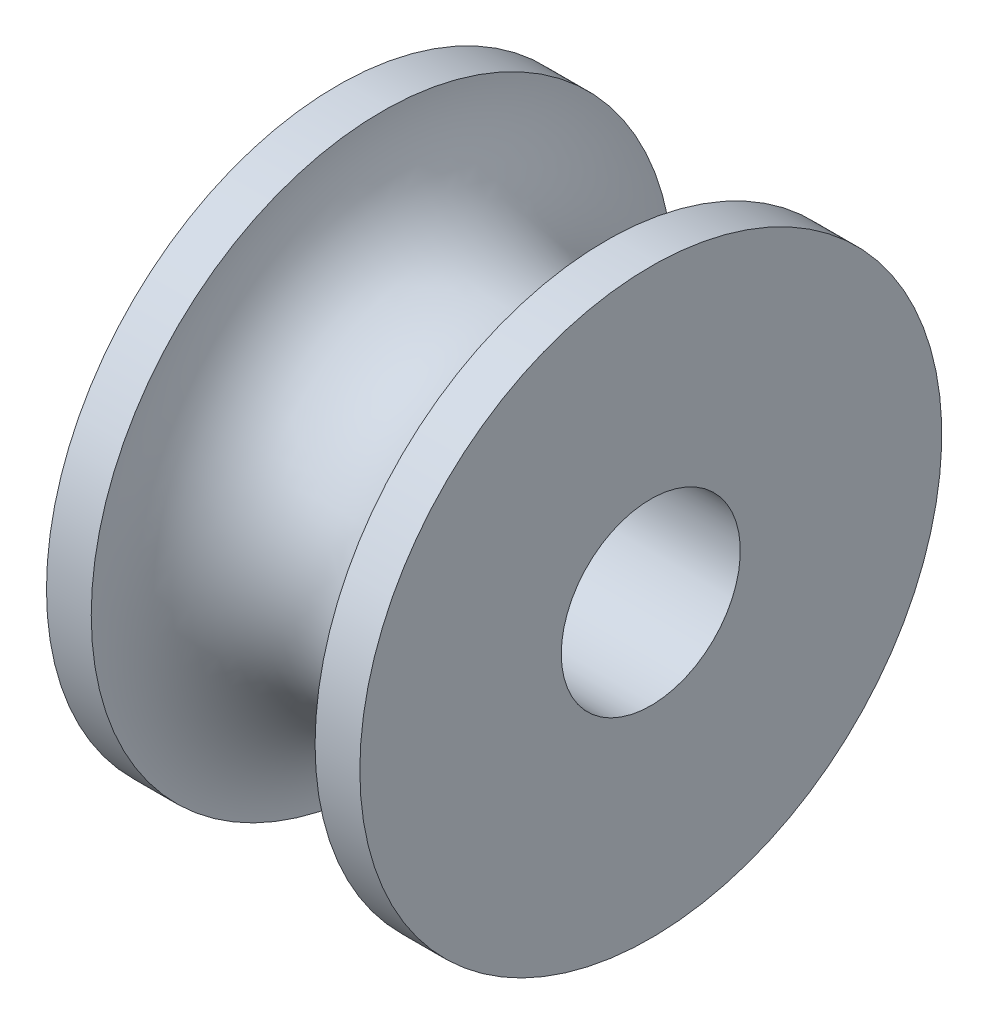
from build123d import *


with BuildPart() as part:
    # Sketch1 → Revolve1 (revolve)
    with BuildSketch(Plane.XY, mode=Mode.PRIVATE) as revolve1_sk:
        with BuildLine():
            Line((-3.5, 2), (-3.5, 6.5))
            Line((-3.5, 6.5), (-2.5, 6.5))
            ThreePointArc((-2.5, 6.5), (0, 4), (2.5, 6.5))
            Line((2.5, 6.5), (3.5, 6.5))
            Line((3.5, 6.5), (3.5, 2))
            Line((3.5, 2), (-3.5, 2))
        make_face()
    revolve(revolve1_sk.sketch.rotate(Axis((0, 0, 0), (1, 0, 0)), 90), axis=Axis((0, 0, 0), (1, 0, 0)))


solid = part.part
